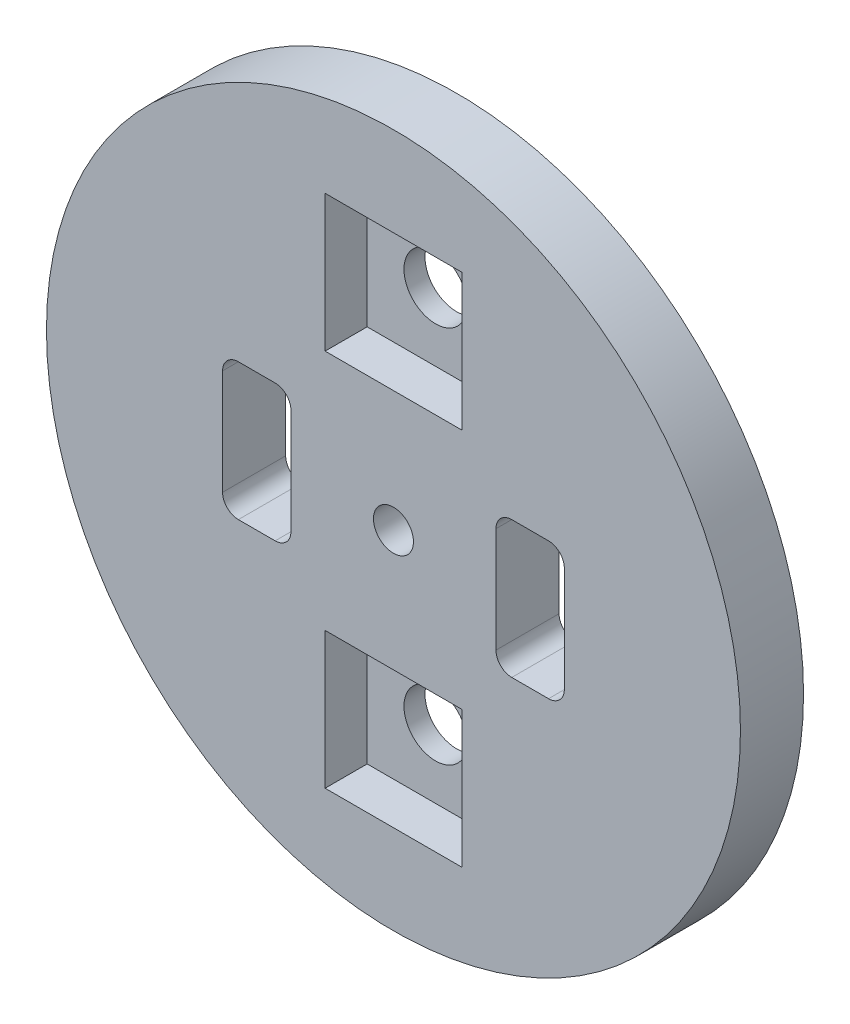
from build123d import *

# Parameters (mm, degrees)
MODEL_R                 = 16.5
MODEL_R_2               = 1.5
MODEL_R_3               = 0.95
SALIENTE_EXTRUIR3_DEPTH = 3
CROQUIS3_W              = 6.5
CROQUIS3_H              = 6.5
CORTAR_EXTRUIR1_DEPTH   = 2
CROQUIS4_W              = 6.500000001
CROQUIS4_H              = 6.5
CORTAR_EXTRUIR2_DEPTH   = 2


with BuildPart() as part:
    # Model → Saliente-Extruir3 (new body)
    with BuildSketch(Plane.XY):
        with Locations((215.747807914, 241.952019993)):
            Circle(MODEL_R)
        with Locations((215.747807914, 250.952019993)):
            Circle(MODEL_R_2, mode=Mode.SUBTRACT)
        with BuildLine():
            ThreePointArc((207.622807913, 244.452019993), (207.842477828, 244.982350079), (208.372807913, 245.202019993))
            Line((208.372807913, 245.202019993), (210.122807913, 245.202019993))
            ThreePointArc((210.122807913, 245.202019993), (210.653137999, 244.982350079), (210.872807913, 244.452019993))
            Line((210.872807913, 244.452019993), (210.872807913, 239.452019993))
            ThreePointArc((210.872807914, 239.452019993), (210.653137999, 238.921689907), (210.122807913, 238.702019993))
            Line((210.122807913, 238.702019993), (208.372807913, 238.702019993))
            ThreePointArc((208.372807913, 238.702019993), (207.842477828, 238.921689907), (207.622807913, 239.452019993))
            Line((207.622807913, 239.452019993), (207.622807913, 244.452019993))
        make_face(mode=Mode.SUBTRACT)
        with BuildLine():
            Line((221.372807913, 245.202019993), (223.122807913, 245.202019993))
            ThreePointArc((223.122807913, 245.202019993), (223.653137999, 244.982350079), (223.872807913, 244.452019993))
            Line((223.872807913, 244.452019993), (223.872807913, 239.452019993))
            ThreePointArc((223.872807914, 239.452019993), (223.653137999, 238.921689907), (223.122807913, 238.702019993))
            Line((223.122807913, 238.702019993), (221.372807913, 238.702019993))
            ThreePointArc((221.372807913, 238.702019993), (220.842477828, 238.921689907), (220.622807913, 239.452019993))
            Line((220.622807913, 239.452019993), (220.622807913, 244.452019993))
            ThreePointArc((220.622807913, 244.452019993), (220.842477828, 244.982350079), (221.372807913, 245.202019993))
        make_face(mode=Mode.SUBTRACT)
        with Locations((215.747807914, 241.952019993)):
            Circle(MODEL_R_3, mode=Mode.SUBTRACT)
        with Locations((215.747807914, 232.952019993)):
            Circle(MODEL_R_2, mode=Mode.SUBTRACT)
    extrude(amount=SALIENTE_EXTRUIR3_DEPTH)

    # Croquis3 → Cortar-Extruir1 (cut)
    with BuildSketch(Plane.XY.offset(3)):
        with Locations((215.747807914, 250.952019993)):
            Rectangle(CROQUIS3_W, CROQUIS3_H)
    extrude(amount=-CORTAR_EXTRUIR1_DEPTH, mode=Mode.SUBTRACT)

    # Croquis4 → Cortar-Extruir2 (cut)
    with BuildSketch(Plane.XY.offset(3)):
        with Locations((215.747807914, 232.952019993)):
            Rectangle(CROQUIS4_W, CROQUIS4_H)
    extrude(amount=-CORTAR_EXTRUIR2_DEPTH, mode=Mode.SUBTRACT)


solid = part.part
